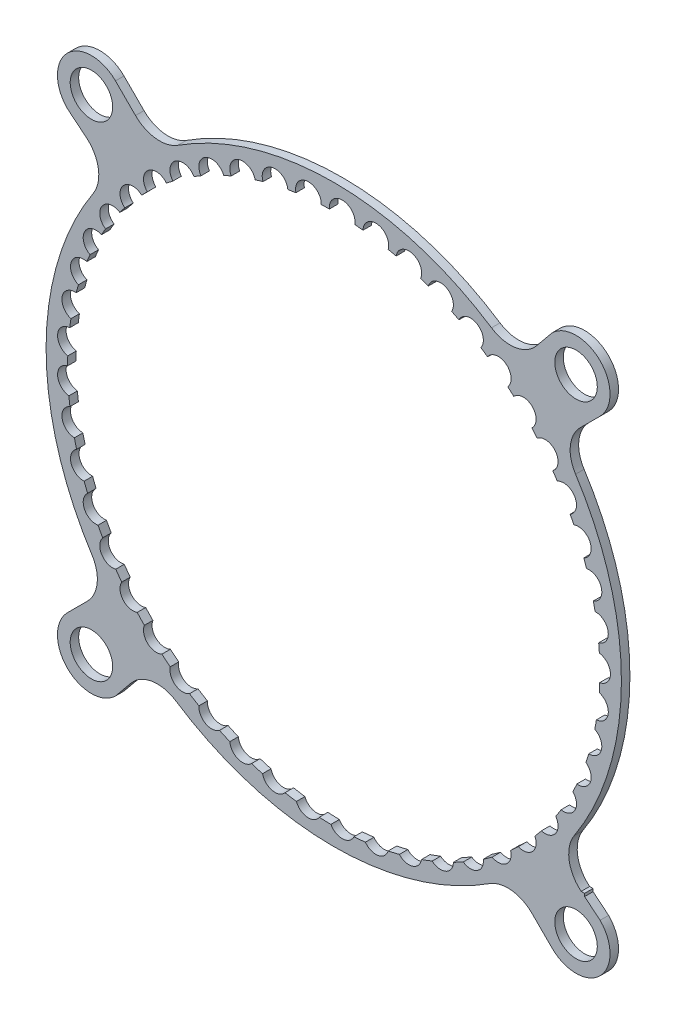
from build123d import *

# Parameters (mm, degrees)
SKETCH_1_R          = 1.51
SKETCH_1_R_2        = 26.499999999
SKETCH_1_R_3        = 2.5
EXTRUDE_1_DEPTH     = 1
SKETCH_2_R          = 31.3
CUT_EXTRUDE_1_DEPTH = 1


with BuildPart() as part:
    # 草图1 → 凸台-拉伸1 (new body)
    with BuildSketch(Plane.XY):
        with BuildLine():
            Line((29.100721778, -23.408930549), (29.502331969, -23.408930549))
            Line((29.502331969, -23.408930549), (29.502331969, -23.738022939))
            Line((29.502331969, -23.738022939), (31.328174592, -25.234177486))
            ThreePointArc((31.328174592, -25.234177486), (31.328174592, -30.891031735), (25.671320342, -30.891031735))
            Line((25.671320342, -30.891031735), (23.320064465, -28.539775858))
            ThreePointArc((23.320064465, -28.539775858), (20.916937037, -27.390877227), (18.325216054, -28.005671376))
            ThreePointArc((18.325216054, -28.005671376), (-0.138932734, -33.397571899), (-18.558178986, -27.854220096))
            ThreePointArc((-18.558178986, -27.854220096), (-21.357328746, -27.244893526), (-23.846073408, -28.663578922))
            Line((-23.846073408, -28.663578922), (-25.671320345, -30.891031735))
            ThreePointArc((-25.671320345, -30.891031735), (-31.328174595, -30.891031735), (-31.328174595, -25.234177486))
            Line((-31.328174595, -25.234177486), (-28.976918718, -22.882921609))
            ThreePointArc((-28.976918718, -22.882921609), (-27.828020086, -20.479794181), (-28.442814235, -17.888073198))
            ThreePointArc((-28.442814235, -17.888073198), (-33.834714759, 0.57607559), (-28.291362955, 18.995321842))
            ThreePointArc((-28.291362955, 18.995321842), (-27.682036385, 21.794471602), (-29.100721781, 24.283216264))
            Line((-29.100721781, 24.283216264), (-31.328174595, 26.108463201))
            ThreePointArc((-31.328174595, 26.108463201), (-31.328174595, 31.765317451), (-25.671320345, 31.765317451))
            Line((-25.671320345, 31.765317451), (-23.320064468, 29.414061574))
            ThreePointArc((-23.320064468, 29.414061574), (-20.91693704, 28.265162943), (-18.325216057, 28.879957091))
            ThreePointArc((-18.325216057, 28.879957091), (0.138932731, 34.271857615), (18.558178983, 28.728505811))
            ThreePointArc((18.558178983, 28.728505811), (21.357328743, 28.119179242), (23.846073405, 29.537864637))
            Line((23.846073405, 29.537864637), (25.671320342, 31.765317451))
            ThreePointArc((25.671320342, 31.765317451), (31.328174592, 31.765317451), (31.328174592, 26.108463201))
            Line((31.328174592, 26.108463201), (28.976918715, 23.757207324))
            ThreePointArc((28.976918715, 23.757207324), (27.828020083, 21.354079896), (28.442814232, 18.762358913))
            ThreePointArc((28.442814232, 18.762358913), (33.834714756, 0.298210125), (28.291362952, -18.121036127))
            ThreePointArc((28.291362952, -18.121036127), (27.682036382, -20.920185887), (29.100721778, -23.408930549))
        make_face()
        with Locations((16.088313358, -26.102212793)):
            Circle(SKETCH_1_R, mode=Mode.SUBTRACT)
        with Locations((12.562451054, -27.941652898)):
            Circle(SKETCH_1_R, mode=Mode.SUBTRACT)
        with Locations((8.830313651, -29.315113962)):
            Circle(SKETCH_1_R, mode=Mode.SUBTRACT)
        with Locations((4.953182742, -30.200043791)):
            Circle(SKETCH_1_R, mode=Mode.SUBTRACT)
        with Locations((0.99472071, -30.581911863)):
            Circle(SKETCH_1_R, mode=Mode.SUBTRACT)
        with Locations((-2.980074609, -30.454447913)):
            Circle(SKETCH_1_R, mode=Mode.SUBTRACT)
        with Locations((-6.905937185, -29.819744897)):
            Circle(SKETCH_1_R, mode=Mode.SUBTRACT)
        with Locations((19.350006001, -23.826997201)):
            Circle(SKETCH_1_R, mode=Mode.SUBTRACT)
        with Locations((-10.718404464, -28.688224621)):
            Circle(SKETCH_1_R, mode=Mode.SUBTRACT)
        with Locations((-14.354875838, -27.078466616)):
            Circle(SKETCH_1_R, mode=Mode.SUBTRACT)
        with Locations((-17.755640547, -25.016903064)):
            Circle(SKETCH_1_R, mode=Mode.SUBTRACT)
        with Locations((-20.864858129, -22.537384782)):
            Circle(SKETCH_1_R, mode=Mode.SUBTRACT)
        with Locations((-23.631475318, -19.680625391)):
            Circle(SKETCH_1_R, mode=Mode.SUBTRACT)
        with Locations((-26.010064335, -16.493532802)):
            Circle(SKETCH_1_R, mode=Mode.SUBTRACT)
        with Locations((-27.961568815, -13.028438986)):
            Circle(SKETCH_1_R, mode=Mode.SUBTRACT)
        with Locations((-29.453945108, -9.342240689)):
            Circle(SKETCH_1_R, mode=Mode.SUBTRACT)
        with Locations((-30.462688437, -5.495465185)):
            Circle(SKETCH_1_R, mode=Mode.SUBTRACT)
        with Locations((-30.971235264, -1.55127642)):
            Circle(SKETCH_1_R, mode=Mode.SUBTRACT)
        with Locations((-30.971235264, 2.425562134)):
            Circle(SKETCH_1_R, mode=Mode.SUBTRACT)
        with Locations((-30.462688437, 6.369750899)):
            Circle(SKETCH_1_R, mode=Mode.SUBTRACT)
        with Locations((-29.453945108, 10.216526404)):
            Circle(SKETCH_1_R, mode=Mode.SUBTRACT)
        with Locations((-27.961568815, 13.902724701)):
            Circle(SKETCH_1_R, mode=Mode.SUBTRACT)
        with Locations((-26.010064335, 17.367818516)):
            Circle(SKETCH_1_R, mode=Mode.SUBTRACT)
        with Locations((-23.631475318, 20.554911106)):
            Circle(SKETCH_1_R, mode=Mode.SUBTRACT)
        with Locations((-20.864858129, 23.411670496)):
            Circle(SKETCH_1_R, mode=Mode.SUBTRACT)
        with Locations((-17.755640547, 25.891188779)):
            Circle(SKETCH_1_R, mode=Mode.SUBTRACT)
        with Locations((-14.354875838, 27.95275233)):
            Circle(SKETCH_1_R, mode=Mode.SUBTRACT)
        with Locations((-10.718404464, 29.562510335)):
            Circle(SKETCH_1_R, mode=Mode.SUBTRACT)
        with Locations((-6.905937185, 30.694030612)):
            Circle(SKETCH_1_R, mode=Mode.SUBTRACT)
        with Locations((-2.980074609, 31.328733628)):
            Circle(SKETCH_1_R, mode=Mode.SUBTRACT)
        with Locations((0.99472071, 31.456197577)):
            Circle(SKETCH_1_R, mode=Mode.SUBTRACT)
        with Locations((4.953182742, 31.074329505)):
            Circle(SKETCH_1_R, mode=Mode.SUBTRACT)
        with Locations((8.830313651, 30.189399676)):
            Circle(SKETCH_1_R, mode=Mode.SUBTRACT)
        with Locations((12.562451054, 28.815938612)):
            Circle(SKETCH_1_R, mode=Mode.SUBTRACT)
        with Locations((16.088313358, 26.976498507)):
            Circle(SKETCH_1_R, mode=Mode.SUBTRACT)
        with Locations((19.350006001, 24.701282916)):
            Circle(SKETCH_1_R, mode=Mode.SUBTRACT)
        with Locations((22.29397208, 22.027650815)):
            Circle(SKETCH_1_R, mode=Mode.SUBTRACT)
        with Locations((24.871871755, 18.999503171)):
            Circle(SKETCH_1_R, mode=Mode.SUBTRACT)
        with Locations((27.041375982, 15.666562084)):
            Circle(SKETCH_1_R, mode=Mode.SUBTRACT)
        with Locations((28.766861564, 12.083554354)):
            Circle(SKETCH_1_R, mode=Mode.SUBTRACT)
        with Locations((30.019996074, 8.309312869)):
            Circle(SKETCH_1_R, mode=Mode.SUBTRACT)
        with Locations((30.780203079, 4.40581057)):
            Circle(SKETCH_1_R, mode=Mode.SUBTRACT)
        with Locations((31.035, 0.437142857)):
            Circle(SKETCH_1_R, mode=Mode.SUBTRACT)
        with Locations((30.780203079, -3.531524856)):
            Circle(SKETCH_1_R, mode=Mode.SUBTRACT)
        with Locations((30.019996074, -7.435027154)):
            Circle(SKETCH_1_R, mode=Mode.SUBTRACT)
        with Locations((28.766861564, -11.209268639)):
            Circle(SKETCH_1_R, mode=Mode.SUBTRACT)
        with Locations((27.041375982, -14.792276369)):
            Circle(SKETCH_1_R, mode=Mode.SUBTRACT)
        with Locations((24.871871755, -18.125217457)):
            Circle(SKETCH_1_R, mode=Mode.SUBTRACT)
        with Locations((22.29397208, -21.153365101)):
            Circle(SKETCH_1_R, mode=Mode.SUBTRACT)
        with Locations((2e-09, 0.437142854)):
            Circle(SKETCH_1_R_2, mode=Mode.SUBTRACT)
        with Locations((28.499747467, -28.062604611)):
            Circle(SKETCH_1_R_3, mode=Mode.SUBTRACT)
        with Locations((-28.49974747, -28.062604611)):
            Circle(SKETCH_1_R_3, mode=Mode.SUBTRACT)
        with Locations((-28.49974747, 28.936890326)):
            Circle(SKETCH_1_R_3, mode=Mode.SUBTRACT)
        with Locations((28.499747467, 28.936890326)):
            Circle(SKETCH_1_R_3, mode=Mode.SUBTRACT)
    extrude(amount=EXTRUDE_1_DEPTH)

    # 草图2 → 切除-拉伸1 (cut)
    with BuildSketch(Plane.XY.offset(1)):
        Circle(SKETCH_2_R)
    extrude(amount=-CUT_EXTRUDE_1_DEPTH, mode=Mode.SUBTRACT)


solid = part.part
